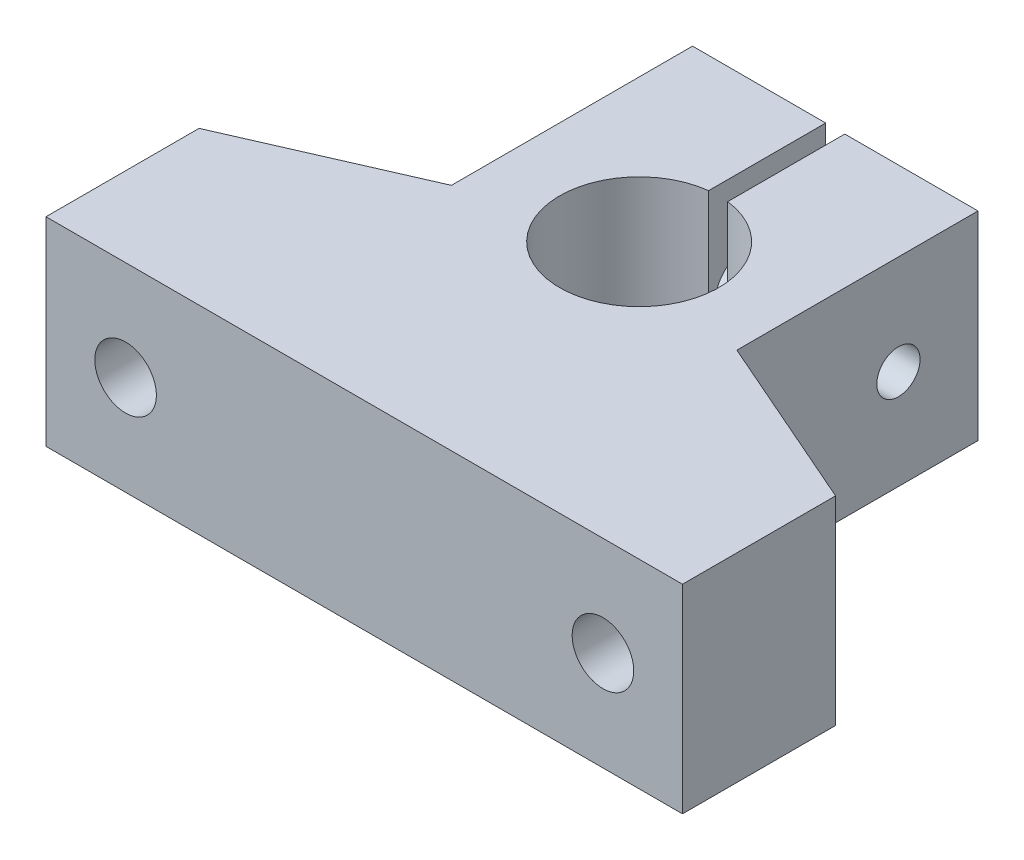
from build123d import *

# Parameters (mm, degrees)
BOSS_EXTRUDE1_DEPTH                            = 15.875
F_8_32_TAPPED_HOLE1_D                          = 3.4544
F_8_32_TAPPED_HOLE1_DEPTH                      = 10.6299
CBORE_FOR_8_SOCKET_HEAD_CAP_SCREW1_D           = 4.9149
CBORE_FOR_8_SOCKET_HEAD_CAP_SCREW1_DEPTH       = 10.6299
CBORE_FOR_8_SOCKET_HEAD_CAP_SCREW1_CBORE_D     = 7.9375
CBORE_FOR_8_SOCKET_HEAD_CAP_SCREW1_CBORE_DEPTH = 4.1656
CBORE_FOR_8_SOCKET_HEAD_CAP_SCREW2_D           = 4.9149
CBORE_FOR_8_SOCKET_HEAD_CAP_SCREW2_CBORE_D     = 7.9375
CBORE_FOR_8_SOCKET_HEAD_CAP_SCREW2_CBORE_DEPTH = 10.5156


with BuildPart() as part:
    # Sketch1 → Boss-Extrude1 (new body)
    with BuildSketch(Plane(origin=(0, 0, 0), x_dir=(1, 0, 0), z_dir=(0, 1, 0))):
        with BuildLine():
            Line((-11.836826281, 27.901732418), (-1.206926281, 27.901732418))
            Line((-1.206926281, 27.901732418), (-1.206926281, 18.554532418))
            ThreePointArc((-1.206926281, 18.554532418), (-0.444926281, 5.900418206), (0.317073719, 18.554532418))
            Line((0.317073719, 18.554532418), (0.317073719, 27.901732418))
            Line((0.317073719, 27.901732418), (10.946973719, 27.901732418))
            Line((10.946973719, 27.901732418), (10.946973719, 8.657386186))
            Line((10.946973719, 8.657386186), (24.955073719, 2.526772877))
            Line((24.955073719, 2.526772877), (24.955073719, -9.690267582))
            Line((24.955073719, -9.690267582), (-25.844926281, -9.690267582))
            Line((-25.844926281, -9.690267582), (-25.844926281, 2.526772877))
            Line((-25.844926281, 2.526772877), (-11.836826281, 8.657386186))
            Line((-11.836826281, 8.657386186), (-11.836826281, 27.901732418))
        make_face()
    extrude(amount=BOSS_EXTRUDE1_DEPTH)

    # #8-32 Tapped Hole1
    with Locations(Plane(origin=(10.946973719, 0, 0), x_dir=(0, 0, -1), z_dir=(1, 0, 0))):
        with Locations((21.551732418, 7.9375)):
            Hole(F_8_32_TAPPED_HOLE1_D / 2, depth=F_8_32_TAPPED_HOLE1_DEPTH)

    # CBORE for #8 Socket Head Cap Screw1
    with Locations(Plane.ZY.offset(11.836826281)):
        with Locations((-21.551732418, 7.9375)):
            CounterBoreHole(CBORE_FOR_8_SOCKET_HEAD_CAP_SCREW1_D / 2, CBORE_FOR_8_SOCKET_HEAD_CAP_SCREW1_CBORE_D / 2, CBORE_FOR_8_SOCKET_HEAD_CAP_SCREW1_CBORE_DEPTH, depth=CBORE_FOR_8_SOCKET_HEAD_CAP_SCREW1_DEPTH)

    # CBORE for #8 Socket Head Cap Screw2 (through all)
    with Locations(Plane(origin=(0, 0, -8.657386186), x_dir=(1, 0, 0), z_dir=(0, 0, -1))):
        with Locations((18.605073719, -7.9375), (-19.494926281, -7.9375)):
            CounterBoreHole(CBORE_FOR_8_SOCKET_HEAD_CAP_SCREW2_D / 2, CBORE_FOR_8_SOCKET_HEAD_CAP_SCREW2_CBORE_D / 2, CBORE_FOR_8_SOCKET_HEAD_CAP_SCREW2_CBORE_DEPTH)


solid = part.part
